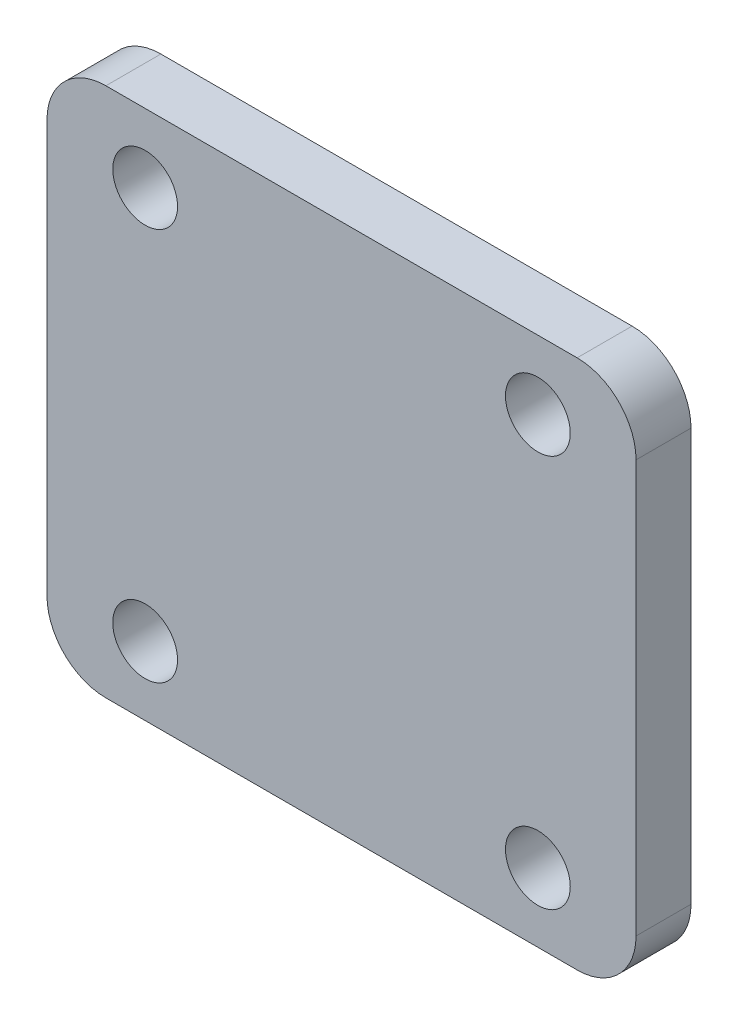
from build123d import *

# Parameters (mm, degrees)
SKETCH_1_W      = 30
SKETCH_1_H      = 27
SKETCH_1_R      = 1.65
EXTRUDE_1_DEPTH = 2.8
FILLET_1_R      = 3


with BuildPart() as part:
    # 草图1 → 凸台-拉伸1 (new body)
    with BuildSketch(Plane.XY):
        with Locations((15, 13.5)):
            Rectangle(SKETCH_1_W, SKETCH_1_H)
        with Locations((5, 23.5)):
            Circle(SKETCH_1_R, mode=Mode.SUBTRACT)
        with Locations(Location((25, 23.5, 0), (0, 0, 180))):
            Circle(SKETCH_1_R, mode=Mode.SUBTRACT)
        with Locations((25, 3.5)):
            Circle(SKETCH_1_R, mode=Mode.SUBTRACT)
        with Locations(Location((5, 3.5, 0), (0, 0, 180))):
            Circle(SKETCH_1_R, mode=Mode.SUBTRACT)
    extrude(amount=EXTRUDE_1_DEPTH)

    # 圆角1
    fillet_1_edges = [part.edges().sort_by_distance(p)[0] for p in [
        (0, 27, 1.4),
        (30, 27, 1.4),
        (30, 0, 1.4),
        (0, 0, 1.4),
    ]]
    fillet(fillet_1_edges, radius=FILLET_1_R)


solid = part.part
